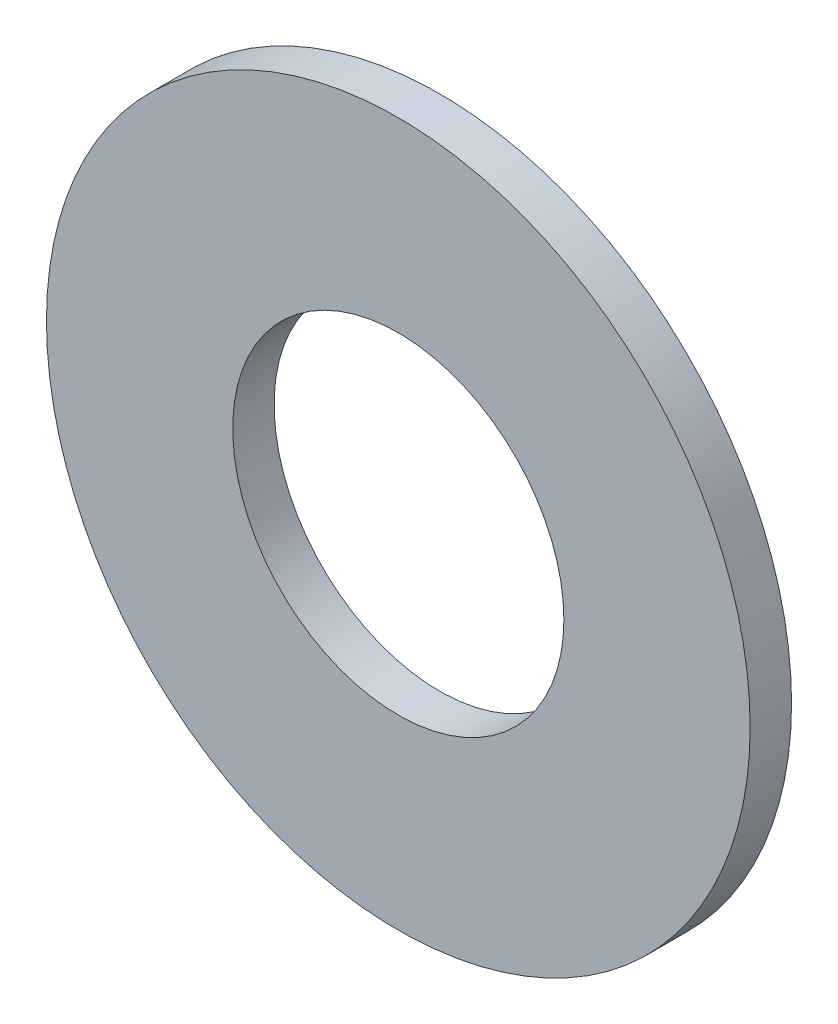
from build123d import *

# Parameters (mm, degrees)
SKETCH_1_R      = 8.5
SKETCH_1_R_2    = 4
EXTRUDE_1_DEPTH = 1


with BuildPart() as part:
    # 스케치1 → 보스-돌출1 (new body)
    with BuildSketch(Plane.XY):
        Circle(SKETCH_1_R)
        Circle(SKETCH_1_R_2, mode=Mode.SUBTRACT)
    extrude(amount=EXTRUDE_1_DEPTH)


solid = part.part
